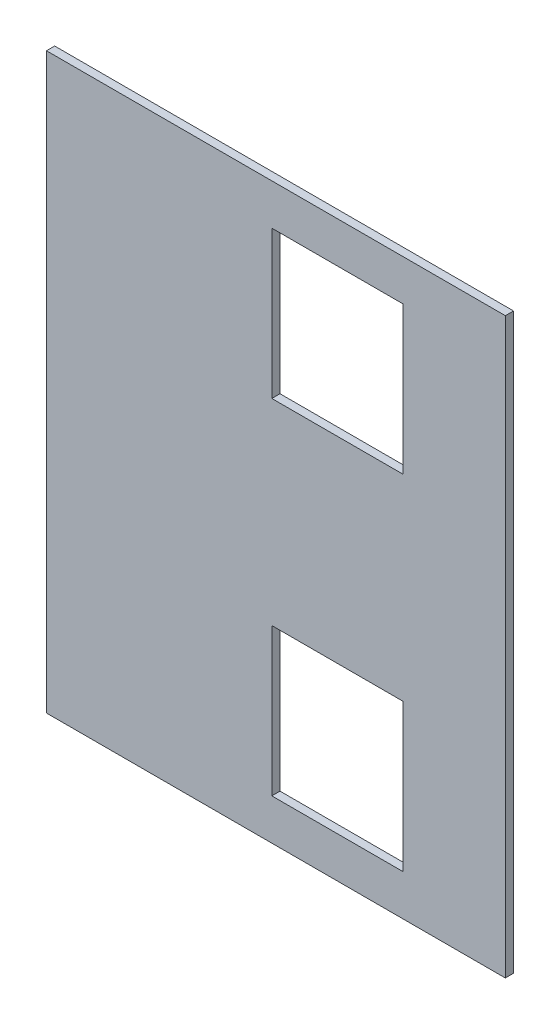
from build123d import *

# Parameters (mm, degrees)
SKETCH_1_W          = 560
SKETCH_1_H          = 700
EXTRUDE_1_DEPTH     = 10
SKETCH_2_W          = 160
SKETCH_2_H          = 180
CUT_EXTRUDE_1_DEPTH = 10


with BuildPart() as part:
    # 草图1 → 凸台-拉伸1 (new body)
    with BuildSketch(Plane.XY):
        with Locations((280, -350)):
            Rectangle(SKETCH_1_W, SKETCH_1_H)
    extrude(amount=EXTRUDE_1_DEPTH)

    # 草图2 → 切除-拉伸1 (cut)
    with BuildSketch(Plane.XY.offset(10)):
        with Locations((355, -140)):
            Rectangle(SKETCH_2_W, SKETCH_2_H)
        with Locations((355, -560)):
            Rectangle(SKETCH_2_W, SKETCH_2_H)
    extrude(amount=-CUT_EXTRUDE_1_DEPTH, mode=Mode.SUBTRACT)


solid = part.part
